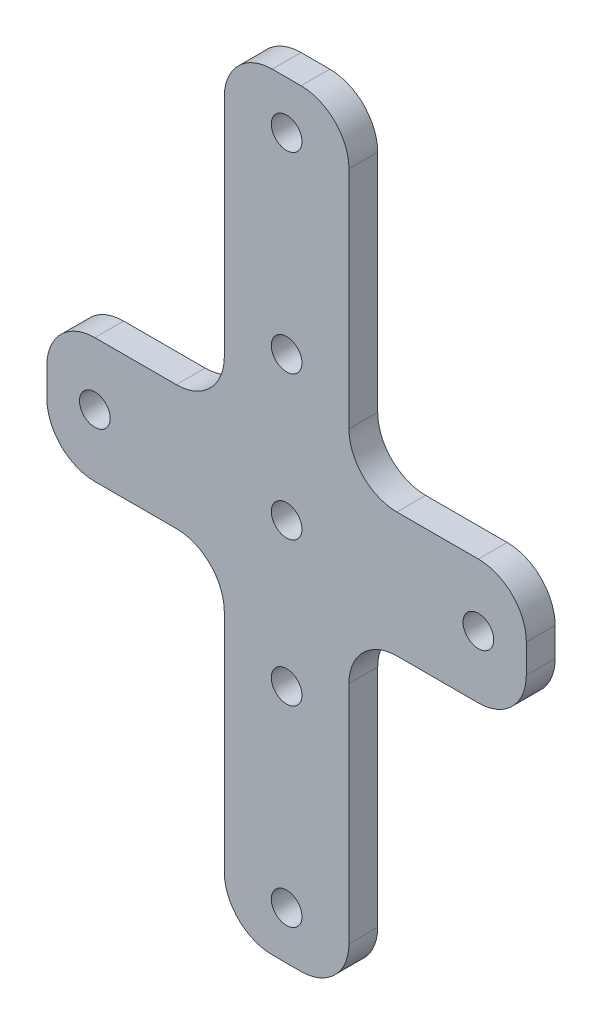
from build123d import *

# Parameters (mm, degrees)
SKETCH_1_R      = 1.6
EXTRUDE_1_DEPTH = 3
FILLET_1_R      = 5


with BuildPart() as part:
    # 草图1 → 凸台-拉伸1 (new body)
    with BuildSketch(Plane.XY):
        Polygon((-6.5, 6.5), (-25, 6.5), (-25, -6.5), (25, -6.5), (25, 6.5), (6.5, 6.5), (6.5, 40), (-6.5, 40), align=None)
        with Locations((0, 35)):
            Circle(SKETCH_1_R, mode=Mode.SUBTRACT)
        with Locations((0, 15)):
            Circle(SKETCH_1_R, mode=Mode.SUBTRACT)
        Circle(SKETCH_1_R, mode=Mode.SUBTRACT)
        with Locations((20, 0)):
            Circle(SKETCH_1_R, mode=Mode.SUBTRACT)
        with Locations((-20, 0)):
            Circle(SKETCH_1_R, mode=Mode.SUBTRACT)
    extrude(amount=EXTRUDE_1_DEPTH)

    # 圆角1
    fillet_1_edges = [part.edges().sort_by_distance(p)[0] for p in [
        (-6.5, 40, 1.5),
        (6.5, 40, 1.5),
        (6.5, 6.5, 1.5),
        (25, 6.5, 1.5),
        (25, -6.5, 1.5),
        (-25, -6.5, 1.5),
        (-25, 6.5, 1.5),
        (-6.5, 6.5, 1.5),
    ]]
    fillet(fillet_1_edges, radius=FILLET_1_R)

    # 镜向1: part across plane


with BuildPart() as part_1:
    add(part.part)
    add(part.part.mirror(Plane.ZX))


solid = part_1.part
